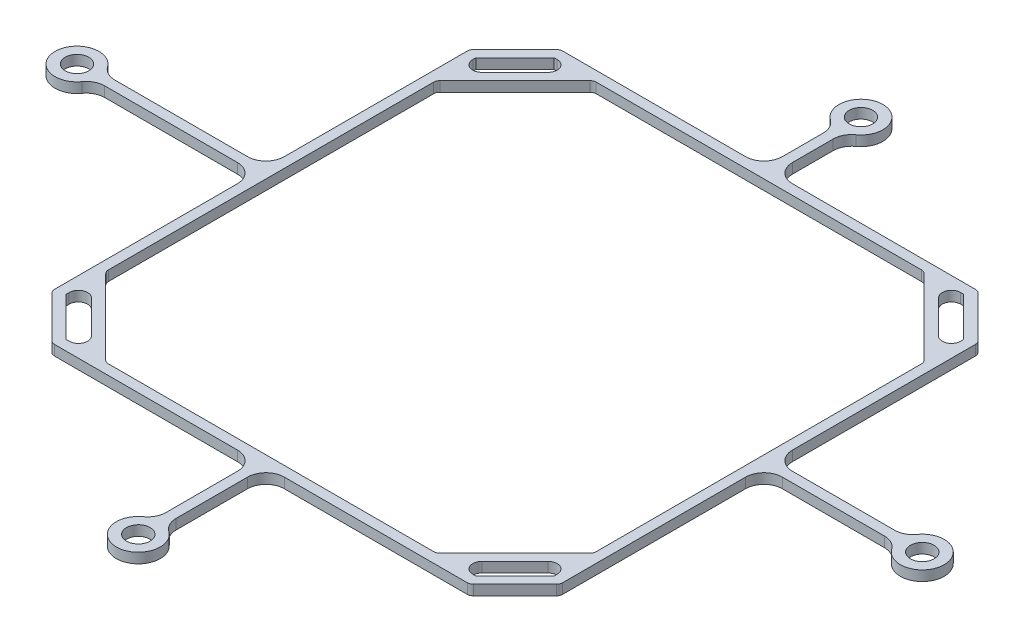
from build123d import *

# Parameters (mm, degrees)
SKETCH1_R           = 1.925
BOSS_EXTRUDE1_DEPTH = 1.65
FILLET4_R           = 3
FILLET3_R           = 1.5
FILLET5_R           = 1


with BuildPart() as part:
    # Sketch1 → Boss-Extrude1 (new body)
    with BuildSketch(Plane(origin=(0, 0, 0), x_dir=(1, 0, 0), z_dir=(0, 1, 0))):
        with BuildLine():
            Line((-41.448800006, 34.091704203), (-34.091704203, 41.448800006))
            Line((-34.091704203, 41.448800006), (-0.825, 41.448800006))
            Line((-0.825, 41.448800006), (-0.825, 52.97029458))
            ThreePointArc((-0.825, 52.97029458), (0, 60.023800006), (0.825, 52.97029458))
            Line((0.825, 52.97029458), (0.825, 41.448800006))
            Line((0.825, 41.448800006), (34.091704203, 41.448800006))
            Line((34.091704203, 41.448800006), (41.448800006, 34.091704203))
            Line((41.448800006, 34.091704203), (41.448800006, 0.825))
            Line((41.448800006, 0.825), (62.97029458, 0.825))
            ThreePointArc((62.97029458, 0.825), (70.023800006, 0), (62.97029458, -0.825))
            Line((62.97029458, -0.825), (41.448800006, -0.825))
            Line((41.448800006, -0.825), (41.448800006, -34.091704203))
            Line((41.448800006, -34.091704203), (34.091704203, -41.448800006))
            Line((34.091704203, -41.448800006), (0.825, -41.448800006))
            Line((0.825, -41.448800006), (0.825, -57.97029458))
            ThreePointArc((0.825, -57.97029458), (0, -65.023800006), (-0.825, -57.97029458))
            Line((-0.825, -57.97029458), (-0.825, -41.448800006))
            Line((-0.825, -41.448800006), (-34.091704203, -41.448800006))
            Line((-34.091704203, -41.448800006), (-41.448800006, -34.091704203))
            Line((-41.448800006, -34.091704203), (-41.448800006, -0.825))
            Line((-41.448800006, -0.825), (-67.97029458, -0.825))
            ThreePointArc((-67.97029458, -0.825), (-75.023800006, 0), (-67.97029458, 0.825))
            Line((-67.97029458, 0.825), (-41.448800006, 0.825))
            Line((-41.448800006, 0.825), (-41.448800006, 34.091704203))
        make_face()
        with Locations(Location((0, 56.448800006, 0), (0, 0, 270))):
            Circle(SKETCH1_R, mode=Mode.SUBTRACT)
        with Locations(Location((66.448800006, 0, 0), (0, 0, 90))):
            Circle(SKETCH1_R, mode=Mode.SUBTRACT)
        with Locations(Location((0, -61.448800006, 0), (0, 0, 270))):
            Circle(SKETCH1_R, mode=Mode.SUBTRACT)
        with Locations(Location((-71.448800006, 0, 0), (0, 0, 270))):
            Circle(SKETCH1_R, mode=Mode.SUBTRACT)
        Polygon((-39.798800006, 33.408251825), (-33.408251825, 39.798800006), (-29.292890359, 39.798800006), (-39.798800006, 29.292890359), align=None, mode=Mode.SUBTRACT)
        Polygon((-33.408251825, -39.798800006), (-29.292890359, -39.798800006), (-39.798800006, -29.292890359), (-39.798800006, -33.408251825), align=None, mode=Mode.SUBTRACT)
        Polygon((39.798800006, -33.408251825), (39.798800006, -29.292890359), (29.292890359, -39.798800006), (33.408251825, -39.798800006), align=None, mode=Mode.SUBTRACT)
        Polygon((33.408251825, 39.798800006), (39.798800006, 33.408251825), (39.798800006, 29.292890359), (29.292890359, 39.798800006), align=None, mode=Mode.SUBTRACT)
        Polygon((-39.798800006, 26.959437981), (-26.959437981, 39.798800006), (26.959437981, 39.798800006), (39.798800006, 26.959437981), (39.798800006, -26.959437981), (26.959437981, -39.798800006), (-26.959437981, -39.798800006), (-39.798800006, -26.959437981), align=None, mode=Mode.SUBTRACT)
    extrude(amount=BOSS_EXTRUDE1_DEPTH)

    # Fillet4
    fillet4_edges = [part.edges().sort_by_distance(p)[0] for p in [
        (-0.825, 0.825, -41.448800006),
        (-0.825, 0.825, -52.97029458),
        (0.825, 0.825, -52.97029458),
        (0.825, 0.825, -41.448800006),
        (41.448800006, 0.825, -0.825),
        (62.97029458, 0.825, -0.825),
        (62.97029458, 0.825, 0.825),
        (41.448800006, 0.825, 0.825),
        (0.825, 0.825, 41.448800006),
        (0.825, 0.825, 57.97029458),
        (-0.825, 0.825, 57.97029458),
        (-0.825, 0.825, 41.448800006),
        (-41.448800006, 0.825, 0.825),
        (-67.97029458, 0.825, 0.825),
        (-67.97029458, 0.825, -0.825),
        (-41.448800006, 0.825, -0.825),
    ]]
    fillet(fillet4_edges, radius=FILLET4_R)

    # Fillet3
    fillet3_edges = [part.edges().sort_by_distance(p)[0] for p in [
        (-29.292890359, 0.825, 39.798800006),
        (-39.798800006, 0.825, 29.292890359),
        (-39.798800006, 0.825, -29.292890359),
        (-29.292890359, 0.825, -39.798800006),
        (29.292890359, 0.825, -39.798800006),
        (39.798800006, 0.825, -29.292890359),
        (39.798800006, 0.825, 29.292890359),
        (29.292890359, 0.825, 39.798800006),
    ]]
    fillet(fillet3_edges, radius=FILLET3_R)

    # Fillet5
    fillet5_edges = [part.edges().sort_by_distance(p)[0] for p in [
        (-39.798800006, 0.825, -26.959437981),
        (-39.798800006, 0.825, 26.959437981),
        (-26.959437981, 0.825, 39.798800006),
        (26.959437981, 0.825, 39.798800006),
        (39.798800006, 0.825, 26.959437981),
        (39.798800006, 0.825, -26.959437981),
        (26.959437981, 0.825, -39.798800006),
        (-26.959437981, 0.825, -39.798800006),
        (-41.448800006, 0.825, -34.091704203),
        (-34.091704203, 0.825, -41.448800006),
        (34.091704203, 0.825, -41.448800006),
        (41.448800006, 0.825, -34.091704203),
        (41.448800006, 0.825, 34.091704203),
        (34.091704203, 0.825, 41.448800006),
        (-34.091704203, 0.825, 41.448800006),
        (-41.448800006, 0.825, 34.091704203),
    ]]
    fillet(fillet5_edges, radius=FILLET5_R)


solid = part.part
